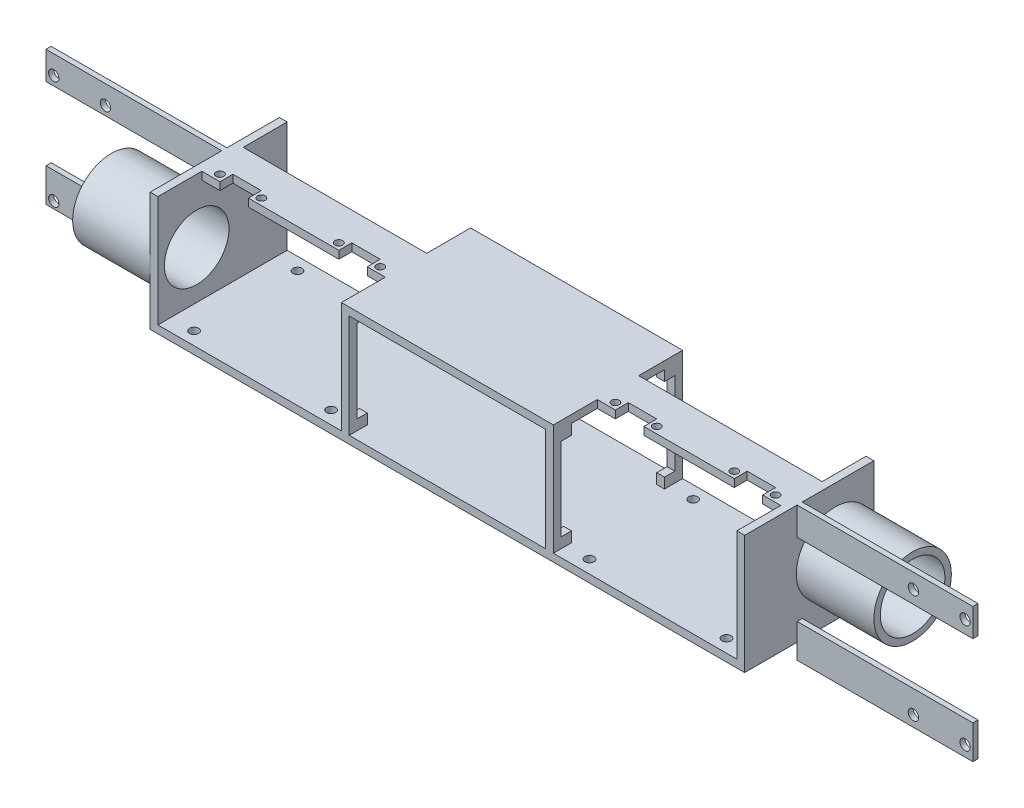
from build123d import *

# Parameters (mm, degrees)
SKETCH1_W               = 82
SKETCH1_H               = 46
BOSS_EXTRUDE1_DEPTH     = 25
CUT_EXTRUDE1_REACH      = 70.629
SKETCH2_W               = 76
SKETCH2_H               = 40
CUT_EXTRUDE2_DEPTH      = 89.758098222
CUT_EXTRUDE2_DEPTH_BACK = 89.758098222
SKETCH4_W               = 50
SKETCH4_H               = 3
BOSS_EXTRUDE2_DEPTH     = 71
CUT_EXTRUDE3_REACH      = 124.548
SKETCH5_R               = 1.75
SKETCH7_W               = 16
SKETCH7_H               = 3
BOSS_EXTRUDE4_DEPTH     = 71
SKETCH8_W               = 50
SKETCH8_H               = 46
BOSS_EXTRUDE5_DEPTH     = 3
CUT_EXTRUDE4_START      = -3
CUT_EXTRUDE4_DEPTH      = 130.356638132
CUT_EXTRUDE5_REACH      = 128.357
SKETCH10_W              = 11
SKETCH10_H              = 5
CUT_EXTRUDE6_REACH      = 128.357
SKETCH11_R              = 1.5
SKETCH12_R              = 15
BOSS_EXTRUDE6_DEPTH     = 30
SKETCH13_R              = 12.5
CUT_EXTRUDE7_DEPTH      = 190.076704012
SKETCH14_W              = 2
SKETCH14_H              = 10.8
SKETCH14_H_2            = 13
BOSS_EXTRUDE7_DEPTH     = 68
CUT_EXTRUDE8_REACH      = 189.343
SKETCH15_R              = 2
SKETCH16_R              = 15
BOSS_EXTRUDE8_DEPTH     = 30
CUT_EXTRUDE9_REACH      = 332.227
SKETCH17_R              = 12.5
SKETCH18_W              = 2
SKETCH18_H              = 10.8
BOSS_EXTRUDE9_DEPTH     = 68
SKETCH19_W              = 2
SKETCH19_H              = 13
BOSS_EXTRUDE10_DEPTH    = 68
CUT_EXTRUDE10_REACH     = 189.343
SKETCH20_R              = 2


with BuildPart() as part:
    # Sketch1 → Boss-Extrude1 (new, symmetric)
    with BuildSketch(Plane.XY):
        Rectangle(SKETCH1_W, SKETCH1_H)
    extrude(amount=BOSS_EXTRUDE1_DEPTH, both=True)

    # Sketch2 → Cut-Extrude1 (cut, up to next)
    with BuildSketch(Plane.XY.offset(25), mode=Mode.PRIVATE) as cut_extrude1_sk1:
        Rectangle(SKETCH2_W, SKETCH2_H)
    cut_extrude1_tool1 = extrude(cut_extrude1_sk1.sketch, amount=-CUT_EXTRUDE1_REACH, mode=Mode.PRIVATE) & part.part
    add(cut_extrude1_tool1.solids().sort_by_distance((0, 0, 25))[0], mode=Mode.SUBTRACT)

    # Sketch3 → Cut-Extrude2 (cut, two sides: drawn at the far end of the back side and taken through both)
    with BuildSketch(Plane.ZY.offset(41).offset(-CUT_EXTRUDE2_DEPTH_BACK)):
        Polygon((-18, 16), (-18, 20), (18, 20), (18, 16), (22, 16), (22, -16), (18, -16), (18, -20), (-18, -20), (-18, -16), (-22, -16), (-22, 16), align=None)
    extrude(amount=CUT_EXTRUDE2_DEPTH + CUT_EXTRUDE2_DEPTH_BACK, mode=Mode.SUBTRACT)

    # Sketch4 → Boss-Extrude2 (add)
    with BuildSketch(Plane(origin=(41, 0, 0), x_dir=(0, 0, -1), z_dir=(1, 0, 0))):
        with Locations((0, -21.5)):
            Rectangle(SKETCH4_W, SKETCH4_H)
    boss_extrude2 = extrude(amount=BOSS_EXTRUDE2_DEPTH)

    # Sketch5 → Cut-Extrude3 (cut, up to next)
    with BuildSketch(Plane(origin=(0, -20, 0), x_dir=(1, 0, 0), z_dir=(0, 1, 0)), mode=Mode.PRIVATE) as cut_extrude3_sk1:
        with Locations(Location((103.1, 20.1, 0), (0, 0, 270))):
            Circle(SKETCH5_R)
    cut_extrude3_tool1 = extrude(cut_extrude3_sk1.sketch, amount=-CUT_EXTRUDE3_REACH, mode=Mode.PRIVATE) & part.part
    # Sketch5 → Cut-Extrude3 (cut, up to next)
    with BuildSketch(Plane(origin=(0, -20, 0), x_dir=(1, 0, 0), z_dir=(0, 1, 0)), mode=Mode.PRIVATE) as cut_extrude3_sk2:
        with Locations(Location((103, -20, 0), (0, 0, 270))):
            Circle(SKETCH5_R)
    cut_extrude3_tool2 = extrude(cut_extrude3_sk2.sketch, amount=-CUT_EXTRUDE3_REACH, mode=Mode.PRIVATE) & part.part
    # Sketch5 → Cut-Extrude3 (cut, up to next)
    with BuildSketch(Plane(origin=(0, -20, 0), x_dir=(1, 0, 0), z_dir=(0, 1, 0)), mode=Mode.PRIVATE) as cut_extrude3_sk3:
        with Locations(Location((50, 20.1, 0), (0, 0, 270))):
            Circle(SKETCH5_R)
    cut_extrude3_tool3 = extrude(cut_extrude3_sk3.sketch, amount=-CUT_EXTRUDE3_REACH, mode=Mode.PRIVATE) & part.part
    # Sketch5 → Cut-Extrude3 (cut, up to next)
    with BuildSketch(Plane(origin=(0, -20, 0), x_dir=(1, 0, 0), z_dir=(0, 1, 0)), mode=Mode.PRIVATE) as cut_extrude3_sk4:
        with Locations(Location((50, -20, 0), (0, 0, 270))):
            Circle(SKETCH5_R)
    cut_extrude3_tool4 = extrude(cut_extrude3_sk4.sketch, amount=-CUT_EXTRUDE3_REACH, mode=Mode.PRIVATE) & part.part
    cut_extrude3_1 = cut_extrude3_tool1.solids().sort_by_distance((103.1, -20, -20.1))[0]
    add(cut_extrude3_1, mode=Mode.SUBTRACT)
    cut_extrude3_2 = cut_extrude3_tool2.solids().sort_by_distance((103, -20, 20))[0]
    add(cut_extrude3_2, mode=Mode.SUBTRACT)
    cut_extrude3_3 = cut_extrude3_tool3.solids().sort_by_distance((50, -20, -20.1))[0]
    add(cut_extrude3_3, mode=Mode.SUBTRACT)
    cut_extrude3_4 = cut_extrude3_tool4.solids().sort_by_distance((50, -20, 20))[0]
    add(cut_extrude3_4, mode=Mode.SUBTRACT)
    cut_extrude3 = cut_extrude3_1 + cut_extrude3_2 + cut_extrude3_3 + cut_extrude3_4  # Cut-Extrude3 as one shape, for the pattern or mirror that repeats it

    # Sketch7 → Boss-Extrude4 (add)
    with BuildSketch(Plane(origin=(41, 0, 0), x_dir=(0, 0, -1), z_dir=(1, 0, 0))):
        with Locations((0, 21.5)):
            Rectangle(SKETCH7_W, SKETCH7_H)
    boss_extrude4 = extrude(amount=BOSS_EXTRUDE4_DEPTH)

    # Sketch8 → Boss-Extrude5 (add)
    with BuildSketch(Plane(origin=(112, 0, 0), x_dir=(0, 0, -1), z_dir=(1, 0, 0))):
        Rectangle(SKETCH8_W, SKETCH8_H)
    boss_extrude5 = extrude(amount=BOSS_EXTRUDE5_DEPTH)

    # Sketch9 → Cut-Extrude4 (cut)
    with BuildSketch(Plane(origin=(0, 23, 0), x_dir=(1, 0, 0), z_dir=(0, 1, 0)).offset(CUT_EXTRUDE4_START)):
        Polygon((105, -317.365996733), (105, -8), (105, -3), (94, -3), (94, -8), (94, -317.365996733), (94, -936.097990199), (105, -936.097990199), align=None)
    cut_extrude4 = extrude(amount=CUT_EXTRUDE4_DEPTH, mode=Mode.SUBTRACT)

    # Sketch10 → Cut-Extrude5 (cut, up to next)
    with BuildSketch(Plane(origin=(0, 23, 0), x_dir=(1, 0, 0), z_dir=(0, 1, 0)), mode=Mode.PRIVATE) as cut_extrude5_sk1:
        with Locations((53.5, -5.5)):
            Rectangle(SKETCH10_W, SKETCH10_H)
    cut_extrude5_tool1 = extrude(cut_extrude5_sk1.sketch, amount=-CUT_EXTRUDE5_REACH, mode=Mode.PRIVATE) & part.part
    cut_extrude5 = cut_extrude5_tool1.solids().sort_by_distance((53.5, 23, 5.5))[0]
    add(cut_extrude5, mode=Mode.SUBTRACT)

    # Sketch11 → Cut-Extrude6 (cut, up to next)
    with BuildSketch(Plane(origin=(0, 23, 0), x_dir=(1, 0, 0), z_dir=(0, 1, 0)), mode=Mode.PRIVATE) as cut_extrude6_sk1:
        with Locations(Location((45.5, -5.5, 0), (0, 0, 270))):
            Circle(SKETCH11_R)
    cut_extrude6_tool1 = extrude(cut_extrude6_sk1.sketch, amount=-CUT_EXTRUDE6_REACH, mode=Mode.PRIVATE) & part.part
    # Sketch11 → Cut-Extrude6 (cut, up to next)
    with BuildSketch(Plane(origin=(0, 23, 0), x_dir=(1, 0, 0), z_dir=(0, 1, 0)), mode=Mode.PRIVATE) as cut_extrude6_sk2:
        with Locations(Location((61.5, -5.5, 0), (0, 0, 270))):
            Circle(SKETCH11_R)
    cut_extrude6_tool2 = extrude(cut_extrude6_sk2.sketch, amount=-CUT_EXTRUDE6_REACH, mode=Mode.PRIVATE) & part.part
    # Sketch11 → Cut-Extrude6 (cut, up to next)
    with BuildSketch(Plane(origin=(0, 23, 0), x_dir=(1, 0, 0), z_dir=(0, 1, 0)), mode=Mode.PRIVATE) as cut_extrude6_sk3:
        with Locations(Location((91.5, -5.5, 0), (0, 0, 270))):
            Circle(SKETCH11_R)
    cut_extrude6_tool3 = extrude(cut_extrude6_sk3.sketch, amount=-CUT_EXTRUDE6_REACH, mode=Mode.PRIVATE) & part.part
    # Sketch11 → Cut-Extrude6 (cut, up to next)
    with BuildSketch(Plane(origin=(0, 23, 0), x_dir=(1, 0, 0), z_dir=(0, 1, 0)), mode=Mode.PRIVATE) as cut_extrude6_sk4:
        with Locations(Location((107.5, -5.5, 0), (0, 0, 270))):
            Circle(SKETCH11_R)
    cut_extrude6_tool4 = extrude(cut_extrude6_sk4.sketch, amount=-CUT_EXTRUDE6_REACH, mode=Mode.PRIVATE) & part.part
    cut_extrude6_1 = cut_extrude6_tool1.solids().sort_by_distance((45.5, 23, 5.5))[0]
    add(cut_extrude6_1, mode=Mode.SUBTRACT)
    cut_extrude6_2 = cut_extrude6_tool2.solids().sort_by_distance((61.5, 23, 5.5))[0]
    add(cut_extrude6_2, mode=Mode.SUBTRACT)
    cut_extrude6_3 = cut_extrude6_tool3.solids().sort_by_distance((91.5, 23, 5.5))[0]
    add(cut_extrude6_3, mode=Mode.SUBTRACT)
    cut_extrude6_4 = cut_extrude6_tool4.solids().sort_by_distance((107.5, 23, 5.5))[0]
    add(cut_extrude6_4, mode=Mode.SUBTRACT)
    cut_extrude6 = cut_extrude6_1 + cut_extrude6_2 + cut_extrude6_3 + cut_extrude6_4  # Cut-Extrude6 as one shape, for the pattern or mirror that repeats it

    # Sketch12 → Boss-Extrude6 (add)
    with BuildSketch(Plane(origin=(115, 0, 0), x_dir=(0, 0, -1), z_dir=(1, 0, 0))):
        with Locations((10, 0)):
            Circle(SKETCH12_R)
    extrude(amount=BOSS_EXTRUDE6_DEPTH)

    # Sketch13 → Cut-Extrude7 (cut, through all)
    with BuildSketch(Plane(origin=(145, 0, 0), x_dir=(0, 0, -1), z_dir=(1, 0, 0))):
        with Locations((10, 0)):
            Circle(SKETCH13_R)
    extrude(amount=-CUT_EXTRUDE7_DEPTH, mode=Mode.SUBTRACT)

    # Sketch14 → Boss-Extrude7 (add)
    with BuildSketch(Plane(origin=(115, 0, 0), x_dir=(0, 0, -1), z_dir=(1, 0, 0))):
        with Locations((-3.7, 17.6)):
            Rectangle(SKETCH14_W, SKETCH14_H)
        with Locations((-3.7, -22.5)):
            Rectangle(SKETCH14_W, SKETCH14_H_2)
    extrude(amount=BOSS_EXTRUDE7_DEPTH)

    # Sketch15 → Cut-Extrude8 (cut, up to next)
    with BuildSketch(Plane(origin=(0, 0, 2.7), x_dir=(-1, 0, 0), z_dir=(0, 0, -1)), mode=Mode.PRIVATE) as cut_extrude8_sk1:
        with Locations(Location((-180, -24.8, 0), (0, 0, 90))):
            Circle(SKETCH15_R)
    cut_extrude8_tool1 = extrude(cut_extrude8_sk1.sketch, amount=-CUT_EXTRUDE8_REACH, mode=Mode.PRIVATE) & part.part
    # Sketch15 → Cut-Extrude8 (cut, up to next)
    with BuildSketch(Plane(origin=(0, 0, 2.7), x_dir=(-1, 0, 0), z_dir=(0, 0, -1)), mode=Mode.PRIVATE) as cut_extrude8_sk2:
        with Locations(Location((-160, -24.8, 0), (0, 0, 90))):
            Circle(SKETCH15_R)
    cut_extrude8_tool2 = extrude(cut_extrude8_sk2.sketch, amount=-CUT_EXTRUDE8_REACH, mode=Mode.PRIVATE) & part.part
    # Sketch15 → Cut-Extrude8 (cut, up to next)
    with BuildSketch(Plane(origin=(0, 0, 2.7), x_dir=(-1, 0, 0), z_dir=(0, 0, -1)), mode=Mode.PRIVATE) as cut_extrude8_sk3:
        with Locations(Location((-160, 17.2, 0), (0, 0, 90))):
            Circle(SKETCH15_R)
    cut_extrude8_tool3 = extrude(cut_extrude8_sk3.sketch, amount=-CUT_EXTRUDE8_REACH, mode=Mode.PRIVATE) & part.part
    # Sketch15 → Cut-Extrude8 (cut, up to next)
    with BuildSketch(Plane(origin=(0, 0, 2.7), x_dir=(-1, 0, 0), z_dir=(0, 0, -1)), mode=Mode.PRIVATE) as cut_extrude8_sk4:
        with Locations(Location((-180, 17.2, 0), (0, 0, 90))):
            Circle(SKETCH15_R)
    cut_extrude8_tool4 = extrude(cut_extrude8_sk4.sketch, amount=-CUT_EXTRUDE8_REACH, mode=Mode.PRIVATE) & part.part
    add(cut_extrude8_tool1.solids().sort_by_distance((180, -24.8, 2.7))[0], mode=Mode.SUBTRACT)
    add(cut_extrude8_tool2.solids().sort_by_distance((160, -24.8, 2.7))[0], mode=Mode.SUBTRACT)
    add(cut_extrude8_tool3.solids().sort_by_distance((160, 17.2, 2.7))[0], mode=Mode.SUBTRACT)
    add(cut_extrude8_tool4.solids().sort_by_distance((180, 17.2, 2.7))[0], mode=Mode.SUBTRACT)

    # Mirror1: Boss-Extrude2, Cut-Extrude3, Boss-Extrude4, Boss-Extrude5, Cut-Extrude4, Cut-Extrude5, Cut-Extrude6 across plane
    add(boss_extrude2.mirror(Plane(origin=(0, 0, 0), x_dir=(0, 0, 1), z_dir=(1, 0, 0))))
    add(cut_extrude3.mirror(Plane(origin=(0, 0, 0), x_dir=(0, 0, 1), z_dir=(1, 0, 0))), mode=Mode.SUBTRACT)
    add(boss_extrude4.mirror(Plane(origin=(0, 0, 0), x_dir=(0, 0, 1), z_dir=(1, 0, 0))))
    add(boss_extrude5.mirror(Plane(origin=(0, 0, 0), x_dir=(0, 0, 1), z_dir=(1, 0, 0))))
    add(cut_extrude4.mirror(Plane(origin=(0, 0, 0), x_dir=(0, 0, 1), z_dir=(1, 0, 0))), mode=Mode.SUBTRACT)
    add(cut_extrude5.mirror(Plane(origin=(0, 0, 0), x_dir=(0, 0, 1), z_dir=(1, 0, 0))), mode=Mode.SUBTRACT)
    add(cut_extrude6.mirror(Plane(origin=(0, 0, 0), x_dir=(0, 0, 1), z_dir=(1, 0, 0))), mode=Mode.SUBTRACT)

    # Sketch16 → Boss-Extrude8 (add)
    with BuildSketch(Plane.ZY.offset(115)):
        with Locations((10, -1.505120408)):
            Circle(SKETCH16_R)
    extrude(amount=BOSS_EXTRUDE8_DEPTH)

    # Sketch17 → Cut-Extrude9 (cut, up to next)
    with BuildSketch(Plane.ZY.offset(145), mode=Mode.PRIVATE) as cut_extrude9_sk1:
        with Locations((10, -1.505120408)):
            Circle(SKETCH17_R)
    cut_extrude9_tool1 = extrude(cut_extrude9_sk1.sketch, amount=-CUT_EXTRUDE9_REACH, mode=Mode.PRIVATE) & part.part
    add(cut_extrude9_tool1.solids().sort_by_distance((-145, -1.50512, 10))[0], mode=Mode.SUBTRACT)

    # Sketch18 → Boss-Extrude9 (add)
    with BuildSketch(Plane.ZY.offset(115)):
        with Locations((-3.7, 17.6)):
            Rectangle(SKETCH18_W, SKETCH18_H)
    extrude(amount=BOSS_EXTRUDE9_DEPTH)

    # Sketch19 → Boss-Extrude10 (add)
    with BuildSketch(Plane.ZY.offset(115)):
        with Locations((-3.7, -22.5)):
            Rectangle(SKETCH19_W, SKETCH19_H)
    extrude(amount=BOSS_EXTRUDE10_DEPTH)

    # Sketch20 → Cut-Extrude10 (cut, up to next)
    with BuildSketch(Plane.XY.offset(-2.7), mode=Mode.PRIVATE) as cut_extrude10_sk1:
        with Locations((-160, 15.694879592)):
            Circle(SKETCH20_R)
    cut_extrude10_tool1 = extrude(cut_extrude10_sk1.sketch, amount=-CUT_EXTRUDE10_REACH, mode=Mode.PRIVATE) & part.part
    # Sketch20 → Cut-Extrude10 (cut, up to next)
    with BuildSketch(Plane.XY.offset(-2.7), mode=Mode.PRIVATE) as cut_extrude10_sk2:
        with Locations((-180, 15.694879592)):
            Circle(SKETCH20_R)
    cut_extrude10_tool2 = extrude(cut_extrude10_sk2.sketch, amount=-CUT_EXTRUDE10_REACH, mode=Mode.PRIVATE) & part.part
    # Sketch20 → Cut-Extrude10 (cut, up to next)
    with BuildSketch(Plane.XY.offset(-2.7), mode=Mode.PRIVATE) as cut_extrude10_sk3:
        with Locations((-160, -26.305120408)):
            Circle(SKETCH20_R)
    cut_extrude10_tool3 = extrude(cut_extrude10_sk3.sketch, amount=-CUT_EXTRUDE10_REACH, mode=Mode.PRIVATE) & part.part
    # Sketch20 → Cut-Extrude10 (cut, up to next)
    with BuildSketch(Plane.XY.offset(-2.7), mode=Mode.PRIVATE) as cut_extrude10_sk4:
        with Locations((-180, -26.305120408)):
            Circle(SKETCH20_R)
    cut_extrude10_tool4 = extrude(cut_extrude10_sk4.sketch, amount=-CUT_EXTRUDE10_REACH, mode=Mode.PRIVATE) & part.part
    add(cut_extrude10_tool1.solids().sort_by_distance((-160, 15.69488, -2.7))[0], mode=Mode.SUBTRACT)
    add(cut_extrude10_tool2.solids().sort_by_distance((-180, 15.69488, -2.7))[0], mode=Mode.SUBTRACT)
    add(cut_extrude10_tool3.solids().sort_by_distance((-160, -26.30512, -2.7))[0], mode=Mode.SUBTRACT)
    add(cut_extrude10_tool4.solids().sort_by_distance((-180, -26.30512, -2.7))[0], mode=Mode.SUBTRACT)


solid = part.part
